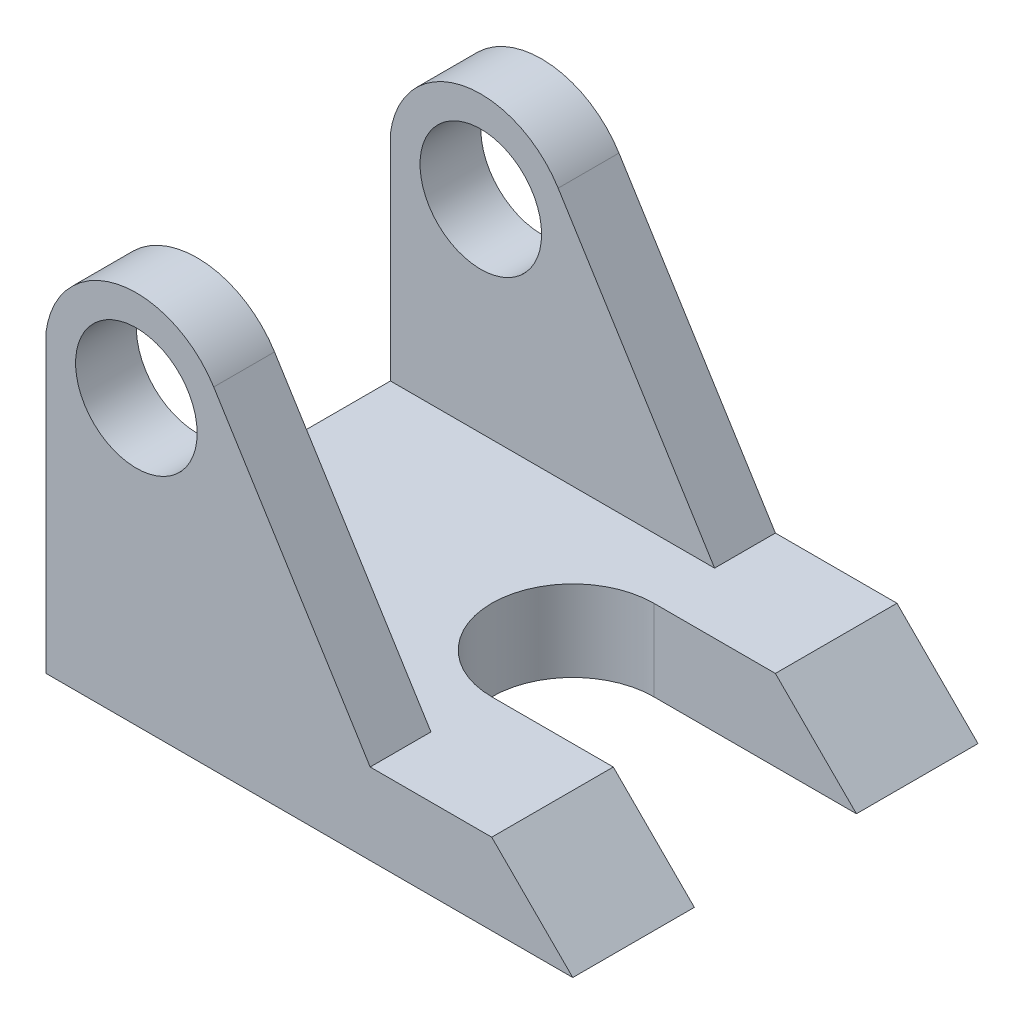
from build123d import *

# Parameters (mm, degrees)
BOSS_EXTRUDE2_DEPTH = 100
CUT_EXTRUDE1_DEPTH  = 121.933866224
BOSS_EXTRUDE6_DEPTH = 15
BOSS_EXTRUDE8_START = -15
BOSS_EXTRUDE8_DEPTH = 15
SKETCH10_R          = 15
CUT_EXTRUDE2_DEPTH  = 151.934588481


with BuildPart() as part:
    # Sketch2 → Boss-Extrude2 (new body)
    with BuildSketch(Plane.XY):
        Polygon((65, 0), (45, 20), (-65, 20), (-65, 0), align=None)
    extrude(amount=-BOSS_EXTRUDE2_DEPTH)

    # Sketch3 → Cut-Extrude1 (cut, through all)
    with BuildSketch(Plane(origin=(0, 20, 0), x_dir=(1, 0, 0), z_dir=(0, 1, 0))):
        with BuildLine():
            Line((65, 70), (15, 70))
            ThreePointArc((15, 70), (-5, 50), (15, 30))
            Line((15, 30), (65, 30))
            Line((65, 30), (65, 70))
        make_face()
    extrude(amount=-CUT_EXTRUDE1_DEPTH, mode=Mode.SUBTRACT)

    # Sketch4 → Boss-Extrude6 (add)
    with BuildSketch(Plane.XY):
        with BuildLine():
            Line((-65, 20), (-65, 72.98579059))
            ThreePointArc((-65, 72.98579059), (-47.439143931, 91.99502078), (-23.607384696, 81.906326611))
            Line((-23.607384696, 81.906326611), (15, 20))
            Line((15, 20), (-65, 20))
        make_face()
    extrude(amount=-BOSS_EXTRUDE6_DEPTH)

    # Sketch9 → Boss-Extrude8 (add)
    with BuildSketch(Plane(origin=(0, 0, -100), x_dir=(-1, 0, 0), z_dir=(0, 0, -1)).offset(BOSS_EXTRUDE8_START)):
        with BuildLine():
            Line((-15, 20), (23.607384696, 81.906326611))
            ThreePointArc((23.607384696, 81.906326611), (47.439143931, 91.99502078), (65, 72.98579059))
            Line((65, 72.98579059), (65, 20))
            Line((65, 20), (-15, 20))
        make_face()
    extrude(amount=BOSS_EXTRUDE8_DEPTH)

    # Sketch10 → Cut-Extrude2 (cut, through all)
    with BuildSketch(Plane.XY):
        with Locations((-42.698989831, 70)):
            Circle(SKETCH10_R)
    extrude(amount=-CUT_EXTRUDE2_DEPTH, mode=Mode.SUBTRACT)


solid = part.part
